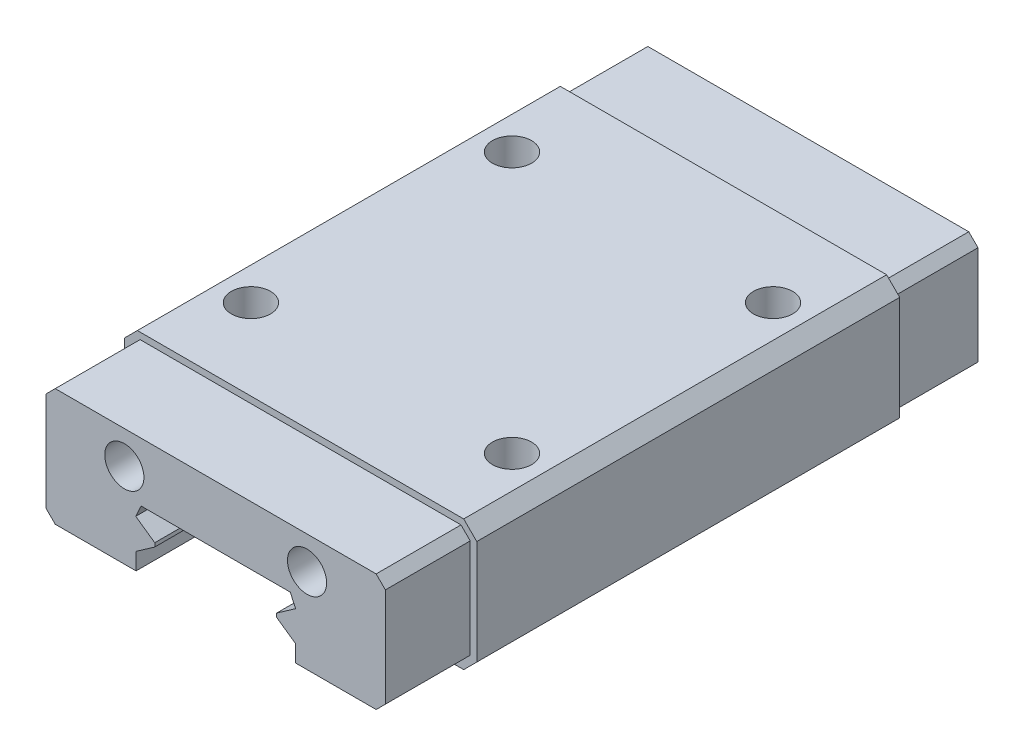
from build123d import *

# Parameters (mm, degrees)
EXTRUDE_1_DEPTH      = 45.4
SKETCH_2_W           = 25
SKETCH_2_H           = 6.5
CUT_EXTRUDE_1_DEPTH  = 0.5
SKETCH_3_W           = 6.5
SKETCH_3_H           = 1.414213562
CUT_EXTRUDE_2_DEPTH  = 0.5
SKETCH_4_W           = 6.5
SKETCH_4_H           = 8
CUT_EXTRUDE_3_DEPTH  = 0.5
SKETCH_5_W           = 6.5
SKETCH_5_H           = 1.414213562
CUT_EXTRUDE_4_DEPTH  = 0.5
SKETCH_6_W           = 6.4
SKETCH_6_H           = 6.5
CUT_EXTRUDE_5_DEPTH  = 0.5
SKETCH_7_W           = 6.5
SKETCH_7_H           = 1.414213563
CUT_EXTRUDE_6_DEPTH  = 0.5
SKETCH_8_W           = 6.5
SKETCH_8_H           = 8
CUT_EXTRUDE_7_DEPTH  = 0.5
SKETCH_9_W           = 6.5
SKETCH_9_H           = 1.414213562
CUT_EXTRUDE_8_DEPTH  = 0.5
SKETCH_10_W          = 6.4
SKETCH_10_H          = 6.5
CUT_EXTRUDE_9_DEPTH  = 0.5
SKETCH_11_W          = 25
SKETCH_11_H          = 6.5
CUT_EXTRUDE_10_DEPTH = 0.5
SKETCH_12_W          = 6.5
SKETCH_12_H          = 1.414213563
CUT_EXTRUDE_11_DEPTH = 0.5
SKETCH_13_W          = 6.5
SKETCH_13_H          = 8
CUT_EXTRUDE_12_DEPTH = 0.5
SKETCH_14_W          = 6.5
SKETCH_14_H          = 1.414213562
CUT_EXTRUDE_13_DEPTH = 0.5
SKETCH_15_W          = 6.4
SKETCH_15_H          = 6.5
CUT_EXTRUDE_14_DEPTH = 0.5
SKETCH_16_W          = 6.5
SKETCH_16_H          = 1.414213562
CUT_EXTRUDE_15_DEPTH = 0.5
SKETCH_17_W          = 6.5
SKETCH_17_H          = 8
CUT_EXTRUDE_16_DEPTH = 0.5
SKETCH_18_W          = 6.5
SKETCH_18_H          = 1.414213562
CUT_EXTRUDE_17_DEPTH = 0.5
SKETCH_19_W          = 6.4
SKETCH_19_H          = 6.5
CUT_EXTRUDE_18_DEPTH = 0.5
SKETCH_20_R          = 1.5
CUT_EXTRUDE_19_DEPTH = 3.5
SKETCH_21_R          = 1.5
CUT_EXTRUDE_21_DEPTH = 3.5
CUT_EXTRUDE_START    = -3.5
SKETCH_22_R          = 1.5
CUT_EXTRUDE_22_DEPTH = 3.5


with BuildPart() as part:
    # 草图1 → 凸台-拉伸1 (new body)
    with BuildSketch(Plane.XY):
        Polygon((-15.119558261, 17.576687619), (-3.69760958, 17.576687619), (-3.282491259, 16.686463507), (-4.740379733, 15.665639007), (-4.740379733, 15.378970272), (-3.30858392, 14.37641605), (-3.30858392, 12.576687619), (3.09141608, 12.576687619), (4.09141608, 13.576687619), (4.09141608, 21.576687619), (3.09141608, 22.576687619), (-21.90858392, 22.576687619), (-22.90858392, 21.576687619), (-22.90858392, 13.576687619), (-21.90858392, 12.576687619), (-15.50858392, 12.576687619), (-15.50858392, 14.37641605), (-14.076788108, 15.378970272), (-14.076788108, 15.665639007), (-15.534676582, 16.686463507), align=None)
    extrude(amount=EXTRUDE_1_DEPTH)

    # 草图2 → 切除-拉伸1 (cut)
    with BuildSketch(Plane(origin=(0, 22.576687619, 0), x_dir=(1, 0, 0), z_dir=(0, 1, 0))):
        with Locations((-9.40858392, -3.25)):
            Rectangle(SKETCH_2_W, SKETCH_2_H)
    extrude(amount=-CUT_EXTRUDE_1_DEPTH, mode=Mode.SUBTRACT)

    # 草图3 → 切除-拉伸2 (cut)
    with BuildSketch(Plane(origin=(-22.24263577, 22.24263577, 0), x_dir=(0, 0, 1), z_dir=(-0.7071067811865477, 0.7071067811865475, 0))):
        with Locations((3.25, -0.234686125)):
            Rectangle(SKETCH_3_W, SKETCH_3_H)
    extrude(amount=-CUT_EXTRUDE_2_DEPTH, mode=Mode.SUBTRACT)

    # 草图4 → 切除-拉伸3 (cut)
    with BuildSketch(Plane.ZY.offset(22.90858392)):
        with Locations((3.25, 17.576687619)):
            Rectangle(SKETCH_4_W, SKETCH_4_H)
    extrude(amount=-CUT_EXTRUDE_3_DEPTH, mode=Mode.SUBTRACT)

    # 草图5 → 切除-拉伸4 (cut)
    with BuildSketch(Plane(origin=(-4.665948151, -4.665948151, 0), x_dir=(0, 0, 1), z_dir=(-0.7071067811865469, -0.7071067811865481, 0))):
        with Locations((3.25, 25.091876138)):
            Rectangle(SKETCH_5_W, SKETCH_5_H)
    extrude(amount=-CUT_EXTRUDE_4_DEPTH, mode=Mode.SUBTRACT)

    # 草图6 → 切除-拉伸5 (cut)
    with BuildSketch(Plane.XZ.offset(-12.576687619)):
        with Locations((-18.70858392, 3.25)):
            Rectangle(SKETCH_6_W, SKETCH_6_H)
    extrude(amount=-CUT_EXTRUDE_5_DEPTH, mode=Mode.SUBTRACT)

    # 草图7 → 切除-拉伸6 (cut)
    with BuildSketch(Plane(origin=(12.834051849, 12.834051849, 0), x_dir=(0, 0, -1), z_dir=(0.7071067811865478, 0.7071067811865472, 0))):
        with Locations((-3.25, 13.071060858)):
            Rectangle(SKETCH_7_W, SKETCH_7_H)
    extrude(amount=-CUT_EXTRUDE_6_DEPTH, mode=Mode.SUBTRACT)

    # 草图8 → 切除-拉伸7 (cut)
    with BuildSketch(Plane(origin=(4.09141608, 0, 0), x_dir=(0, 0, -1), z_dir=(1, 0, 0))):
        with Locations((-3.25, 17.576687619)):
            Rectangle(SKETCH_8_W, SKETCH_8_H)
    extrude(amount=-CUT_EXTRUDE_7_DEPTH, mode=Mode.SUBTRACT)

    # 草图9 → 切除-拉伸8 (cut)
    with BuildSketch(Plane(origin=(-4.74263577, 4.74263577, 0), x_dir=(0, 0, -1), z_dir=(0.7071067811865472, -0.7071067811865478, 0))):
        with Locations((-3.25, 11.786129155)):
            Rectangle(SKETCH_9_W, SKETCH_9_H)
    extrude(amount=-CUT_EXTRUDE_8_DEPTH, mode=Mode.SUBTRACT)

    # 草图10 → 切除-拉伸9 (cut)
    with BuildSketch(Plane.XZ.offset(-12.576687619)):
        with Locations((-0.10858392, 3.25)):
            Rectangle(SKETCH_10_W, SKETCH_10_H)
    extrude(amount=-CUT_EXTRUDE_9_DEPTH, mode=Mode.SUBTRACT)

    # 草图11 → 切除-拉伸10 (cut)
    with BuildSketch(Plane(origin=(0, 22.576687619, 0), x_dir=(1, 0, 0), z_dir=(0, 1, 0))):
        with Locations((-9.40858392, -42.15)):
            Rectangle(SKETCH_11_W, SKETCH_11_H)
    extrude(amount=-CUT_EXTRUDE_10_DEPTH, mode=Mode.SUBTRACT)

    # 草图12 → 切除-拉伸11 (cut)
    with BuildSketch(Plane(origin=(12.834051849, 12.834051849, 0), x_dir=(0, 0, -1), z_dir=(0.7071067811865478, 0.7071067811865472, 0))):
        with Locations((-42.15, 13.071060858)):
            Rectangle(SKETCH_12_W, SKETCH_12_H)
    extrude(amount=-CUT_EXTRUDE_11_DEPTH, mode=Mode.SUBTRACT)

    # 草图13 → 切除-拉伸12 (cut)
    with BuildSketch(Plane(origin=(4.09141608, 0, 0), x_dir=(0, 0, -1), z_dir=(1, 0, 0))):
        with Locations((-42.15, 17.576687619)):
            Rectangle(SKETCH_13_W, SKETCH_13_H)
    extrude(amount=-CUT_EXTRUDE_12_DEPTH, mode=Mode.SUBTRACT)

    # 草图14 → 切除-拉伸13 (cut)
    with BuildSketch(Plane(origin=(-4.74263577, 4.74263577, 0), x_dir=(0, 0, -1), z_dir=(0.7071067811865472, -0.7071067811865478, 0))):
        with Locations((-42.15, 11.786129155)):
            Rectangle(SKETCH_14_W, SKETCH_14_H)
    extrude(amount=-CUT_EXTRUDE_13_DEPTH, mode=Mode.SUBTRACT)

    # 草图15 → 切除-拉伸14 (cut)
    with BuildSketch(Plane.XZ.offset(-12.576687619)):
        with Locations((-0.10858392, 42.15)):
            Rectangle(SKETCH_15_W, SKETCH_15_H)
    extrude(amount=-CUT_EXTRUDE_14_DEPTH, mode=Mode.SUBTRACT)

    # 草图16 → 切除-拉伸15 (cut)
    with BuildSketch(Plane(origin=(-22.24263577, 22.24263577, 0), x_dir=(0, 0, 1), z_dir=(-0.7071067811865477, 0.7071067811865475, 0))):
        with Locations((42.15, -0.234686125)):
            Rectangle(SKETCH_16_W, SKETCH_16_H)
    extrude(amount=-CUT_EXTRUDE_15_DEPTH, mode=Mode.SUBTRACT)

    # 草图17 → 切除-拉伸16 (cut)
    with BuildSketch(Plane.ZY.offset(22.90858392)):
        with Locations((42.15, 17.576687619)):
            Rectangle(SKETCH_17_W, SKETCH_17_H)
    extrude(amount=-CUT_EXTRUDE_16_DEPTH, mode=Mode.SUBTRACT)

    # 草图18 → 切除-拉伸17 (cut)
    with BuildSketch(Plane(origin=(-4.665948151, -4.665948151, 0), x_dir=(0, 0, 1), z_dir=(-0.7071067811865469, -0.7071067811865481, 0))):
        with Locations((42.15, 25.091876138)):
            Rectangle(SKETCH_18_W, SKETCH_18_H)
    extrude(amount=-CUT_EXTRUDE_17_DEPTH, mode=Mode.SUBTRACT)

    # 草图19 → 切除-拉伸18 (cut)
    with BuildSketch(Plane.XZ.offset(-12.576687619)):
        with Locations((-18.70858392, 42.15)):
            Rectangle(SKETCH_19_W, SKETCH_19_H)
    extrude(amount=-CUT_EXTRUDE_18_DEPTH, mode=Mode.SUBTRACT)

    # 草图20 → 切除-拉伸19 (cut)
    with BuildSketch(Plane(origin=(0, 22.576687619, 0), x_dir=(1, 0, 0), z_dir=(0, 1, 0))):
        with Locations(Location((-19.40858392, -12.7, 0), (0, 0, 270))):
            Circle(SKETCH_20_R)
        with Locations(Location((0.59141608, -12.7, 0), (0, 0, 270))):
            Circle(SKETCH_20_R)
        with Locations(Location((0.59141608, -32.7, 0), (0, 0, 270))):
            Circle(SKETCH_20_R)
        with Locations(Location((-19.40858392, -32.7, 0), (0, 0, 270))):
            Circle(SKETCH_20_R)
    extrude(amount=-CUT_EXTRUDE_19_DEPTH, mode=Mode.SUBTRACT)

    # 草图21 → 切除-拉伸21 (cut)
    with BuildSketch(Plane.XY.offset(45.4)):
        with Locations((-16.40858392, 19.576687619)):
            Circle(SKETCH_21_R)
        with Locations((-2.40858392, 19.576687619)):
            Circle(SKETCH_21_R)
    extrude(amount=-CUT_EXTRUDE_21_DEPTH, mode=Mode.SUBTRACT)

    # 草图22 → 切除-拉伸22 (cut)
    with BuildSketch(Plane(origin=(0, 0, 0), x_dir=(-1, 0, 0), z_dir=(0, 0, -1)).offset(CUT_EXTRUDE_START)):
        with Locations(Location((2.40858392, 19.576687619, 0), (0, 0, 180))):
            Circle(SKETCH_22_R)
        with Locations(Location((16.40858392, 19.576687619, 0), (0, 0, 180))):
            Circle(SKETCH_22_R)
    extrude(amount=CUT_EXTRUDE_22_DEPTH, mode=Mode.SUBTRACT)


solid = part.part
